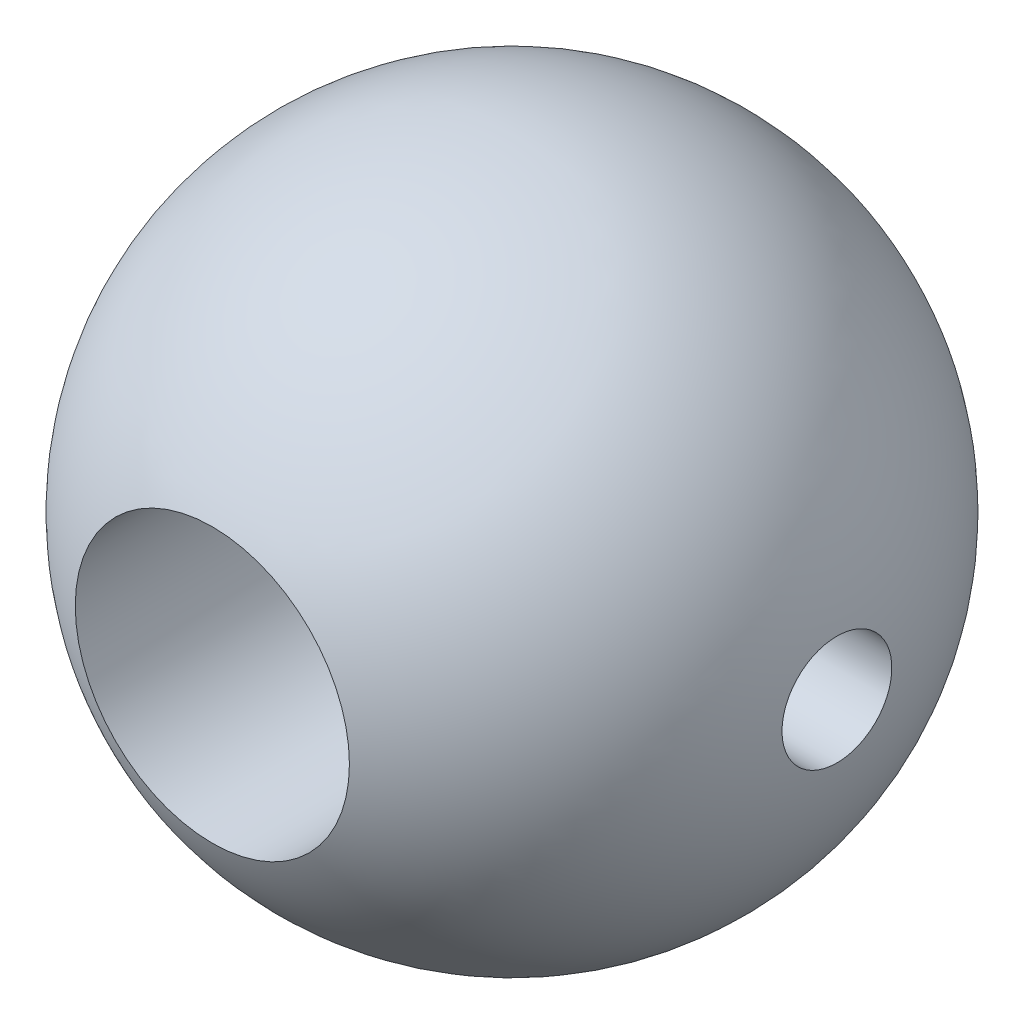
from build123d import *

# Parameters (mm, degrees)
SKETCH2_W = 25.496634157
SKETCH2_H = 1.5875


with BuildPart() as part:
    # Sketch1 → Revolve1 (revolve)
    with BuildSketch(Plane(origin=(0, 0, 0), x_dir=(1, 0, 0), z_dir=(0, 1, 0))):
        with BuildLine():
            Line((3.9624, 8.661697942), (3.9624, -8.661697942))
            ThreePointArc((3.9624, -8.661697942), (9.525, 0), (3.9624, 8.661697942))
        make_face()
    revolve(axis=Axis((0, 0, -15.855540096), (0, 0, 1)))

    # Sketch2 → Cut-Revolve1 (revolve, cut)
    with BuildSketch(Plane(origin=(0, 0, 0), x_dir=(1, 0, 0), z_dir=(0, 1, 0)), mode=Mode.PRIVATE) as cut_revolve1_sk:
        with Locations((-0.355393732, 0.79375)):
            Rectangle(SKETCH2_W, SKETCH2_H)
    revolve(cut_revolve1_sk.sketch.rotate(Axis((-13.10371081, 0, 0), (1, 0, 0)), 180), axis=Axis((-13.10371081, 0, 0), (1, 0, 0)), mode=Mode.SUBTRACT)


solid = part.part
